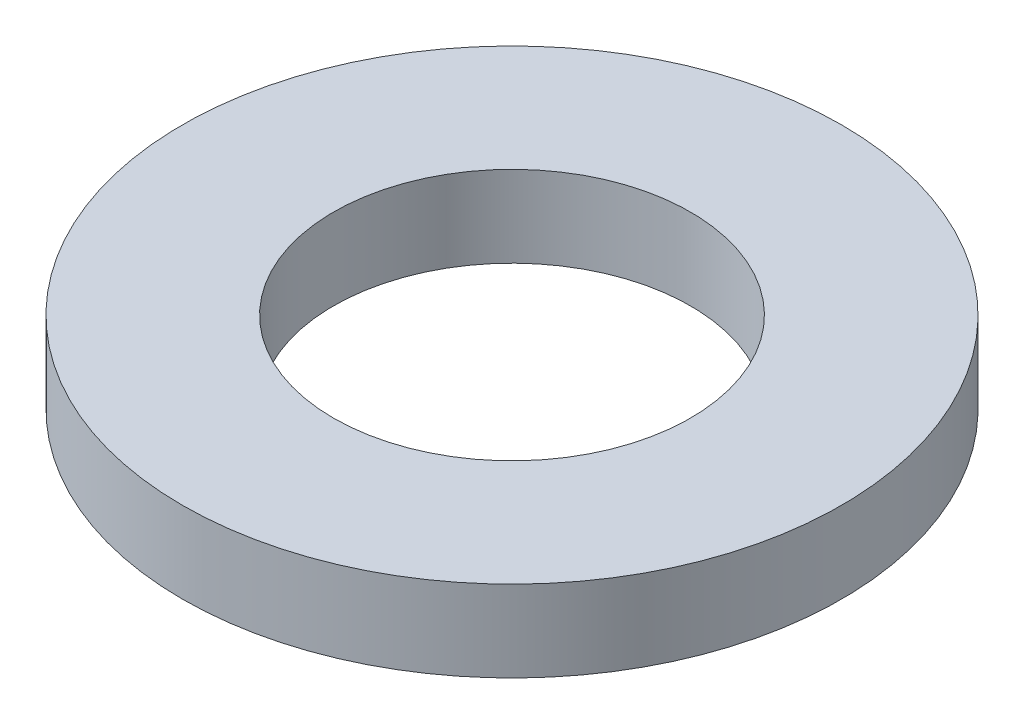
from build123d import *

# Parameters (mm, degrees)
SKETCH1_R           = 6
SKETCH1_R_2         = 3.25
BOSS_EXTRUDE1_DEPTH = 0.74


with BuildPart() as part:
    # Sketch1 → Boss-Extrude1 (new, symmetric)
    with BuildSketch(Plane(origin=(0, 0, 0), x_dir=(1, 0, 0), z_dir=(0, 1, 0))):
        with Locations(Location((0, 0, 0), (0, 0, 270))):
            Circle(SKETCH1_R)
        with Locations(Location((0, 0, 0), (0, 0, 270))):
            Circle(SKETCH1_R_2, mode=Mode.SUBTRACT)
    extrude(amount=BOSS_EXTRUDE1_DEPTH, both=True)


solid = part.part
